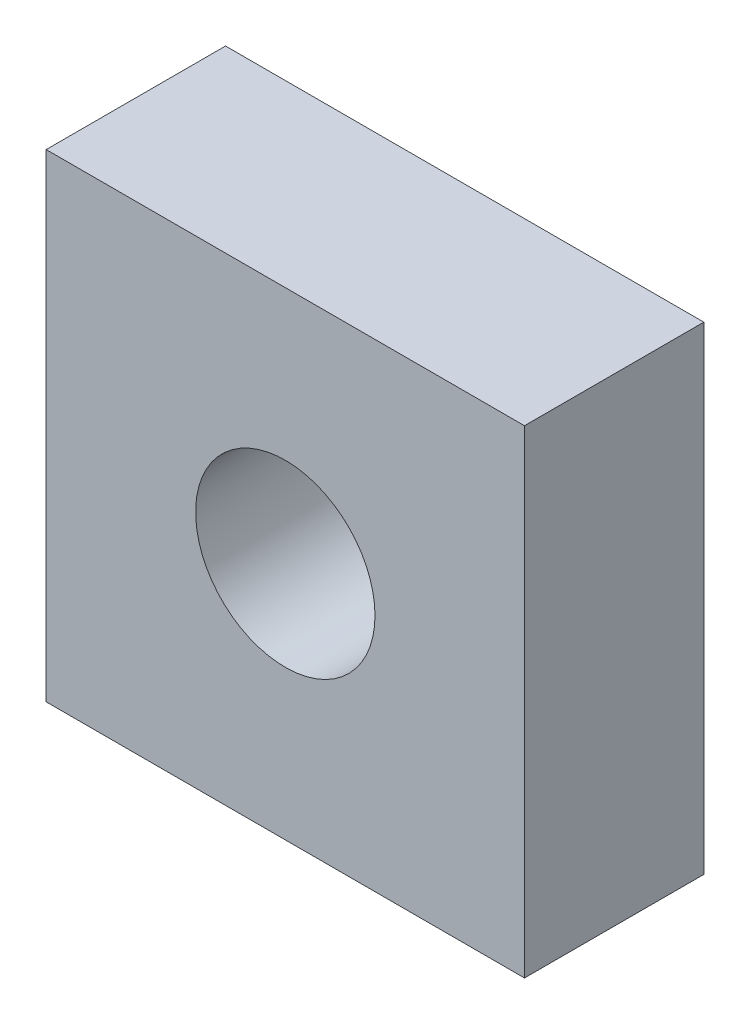
from build123d import *

# Parameters (mm, degrees)
SKETCH_1_W          = 8
SKETCH_1_H          = 8
EXTRUDE_1_DEPTH     = 3
SKETCH_2_R          = 1.5
CUT_EXTRUDE_1_DEPTH = 12.704699911


with BuildPart() as part:
    # Эскиз1 → Бобышка-Вытянуть1 (new body)
    with BuildSketch(Plane.XY):
        with Locations((4, 4)):
            Rectangle(SKETCH_1_W, SKETCH_1_H)
    extrude(amount=EXTRUDE_1_DEPTH)

    # Эскиз2 → Вырез-Вытянуть1 (cut, through all)
    with BuildSketch(Plane.XY.offset(3)):
        with Locations((4, 4)):
            Circle(SKETCH_2_R)
    extrude(amount=-CUT_EXTRUDE_1_DEPTH, mode=Mode.SUBTRACT)


solid = part.part
